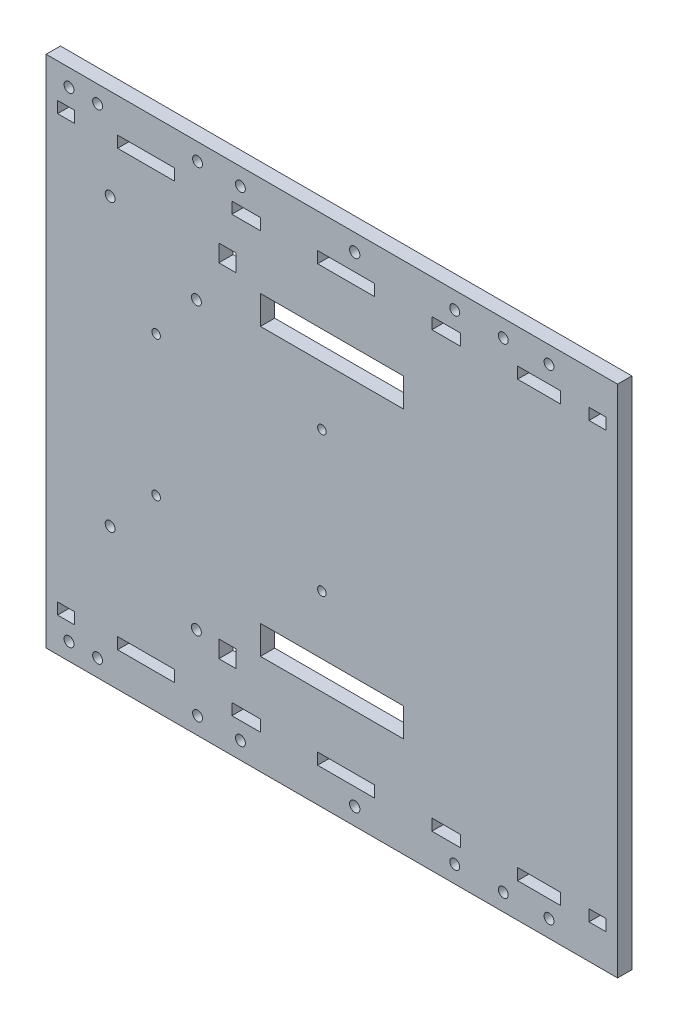
from build123d import *

# Parameters (mm, degrees)
SKETCH1_W           = 200
SKETCH1_H           = 180
BOSS_EXTRUDE1_DEPTH = 5
SKETCH3_W           = 20
SKETCH3_H           = 4
CUT_EXTRUDE1_DEPTH  = 5
SKETCH3_6_W         = 20
SKETCH3_6_H         = 4
CUT_EXTRUDE2_DEPTH  = 5
SKETCH3_7_W         = 15
SKETCH3_7_H         = 4
CUT_EXTRUDE3_DEPTH  = 5
SKETCH5_R           = 1.73
CUT_EXTRUDE4_DEPTH  = 5
SKETCH6_W           = 6
SKETCH6_H           = 4
SKETCH6_W_2         = 10
CUT_EXTRUDE5_DEPTH  = 5
SKETCH6_4_W         = 10
SKETCH6_4_H         = 4
SKETCH6_4_W_2       = 6
CUT_EXTRUDE6_DEPTH  = 5
SKETCH7_R           = 1.73
SKETCH7_R_2         = 1.8
CUT_EXTRUDE7_DEPTH  = 5
CUT_EXTRUDE8_DEPTH  = 5
SKETCH9_R           = 1.5
CUT_EXTRUDE11_DEPTH = 5
SKETCH10_R          = 1.73
CUT_EXTRUDE12_DEPTH = 5
SKETCH10_3_R        = 1.73
CUT_EXTRUDE13_DEPTH = 5
SKETCH11_W          = 6
SKETCH11_H          = 6
CUT_EXTRUDE14_DEPTH = 5


with BuildPart() as part:
    # Sketch1 → Boss-Extrude1 (new body)
    with BuildSketch(Plane.XY):
        Rectangle(SKETCH1_W, SKETCH1_H)
    extrude(amount=BOSS_EXTRUDE1_DEPTH)

    # Sketch3 → Cut-Extrude1 (cut)
    with BuildSketch(Plane.XY.offset(5)):
        with Locations((-65, 76)):
            Rectangle(SKETCH3_W, SKETCH3_H)
    cut_extrude1 = extrude(amount=-CUT_EXTRUDE1_DEPTH, mode=Mode.SUBTRACT)

    # Sketch3<6> → Cut-Extrude2 (cut)
    with BuildSketch(Plane.XY.offset(5)):
        with Locations((5, 76)):
            Rectangle(SKETCH3_6_W, SKETCH3_6_H)
    cut_extrude2 = extrude(amount=-CUT_EXTRUDE2_DEPTH, mode=Mode.SUBTRACT)

    # Sketch3<7> → Cut-Extrude3 (cut)
    with BuildSketch(Plane.XY.offset(5)):
        with Locations((72.5, 76)):
            Rectangle(SKETCH3_7_W, SKETCH3_7_H)
    cut_extrude3 = extrude(amount=-CUT_EXTRUDE3_DEPTH, mode=Mode.SUBTRACT)

    # Mirror1: Cut-Extrude1, Cut-Extrude2, Cut-Extrude3 across plane
    add(cut_extrude1.mirror(Plane.ZX), mode=Mode.SUBTRACT)
    add(cut_extrude2.mirror(Plane.ZX), mode=Mode.SUBTRACT)
    add(cut_extrude3.mirror(Plane.ZX), mode=Mode.SUBTRACT)

    # Sketch5 → Cut-Extrude4 (cut)
    with BuildSketch(Plane.XY.offset(5)):
        with Locations((-92, -84)):
            Circle(SKETCH5_R)
        with Locations((-32, -84)):
            Circle(SKETCH5_R)
        with Locations((43, -84)):
            Circle(SKETCH5_R)
        with Locations((76, -84)):
            Circle(SKETCH5_R)
    cut_extrude4 = extrude(amount=-CUT_EXTRUDE4_DEPTH, mode=Mode.SUBTRACT)

    # Mirror2: Cut-Extrude4 across plane
    add(cut_extrude4.mirror(Plane.ZX), mode=Mode.SUBTRACT)

    # Sketch6 → Cut-Extrude5 (cut)
    with BuildSketch(Plane.XY.offset(5)):
        with Locations((-93, 76)):
            Rectangle(SKETCH6_W, SKETCH6_H)
        with Locations((-30, 76)):
            Rectangle(SKETCH6_W_2, SKETCH6_H)
    cut_extrude5 = extrude(amount=-CUT_EXTRUDE5_DEPTH, mode=Mode.SUBTRACT)

    # Sketch6<4> → Cut-Extrude6 (cut)
    with BuildSketch(Plane.XY.offset(5)):
        with Locations((40, 76)):
            Rectangle(SKETCH6_4_W, SKETCH6_4_H)
        with Locations((93, 76)):
            Rectangle(SKETCH6_4_W_2, SKETCH6_4_H)
    cut_extrude6 = extrude(amount=-CUT_EXTRUDE6_DEPTH, mode=Mode.SUBTRACT)

    # Mirror3: Cut-Extrude5, Cut-Extrude6 across plane
    add(cut_extrude5.mirror(Plane.ZX), mode=Mode.SUBTRACT)
    add(cut_extrude6.mirror(Plane.ZX), mode=Mode.SUBTRACT)

    # Sketch7 → Cut-Extrude7 (cut)
    with BuildSketch(Plane.XY.offset(5)):
        with Locations((-82, -84)):
            Circle(SKETCH7_R)
        with Locations((-47, -84)):
            Circle(SKETCH7_R)
        with Locations((8, -84)):
            Circle(SKETCH7_R_2)
        with Locations((60, -84)):
            Circle(SKETCH7_R)
    cut_extrude7 = extrude(amount=-CUT_EXTRUDE7_DEPTH, mode=Mode.SUBTRACT)

    # Mirror4: Cut-Extrude7 across plane
    add(cut_extrude7.mirror(Plane.ZX), mode=Mode.SUBTRACT)

    # Sketch8 → Cut-Extrude8 (cut)
    with BuildSketch(Plane.XY.offset(5)):
        Polygon((0, 45), (25, 45), (25, 55), (0, 55), (-25, 55), (-25, 45), align=None)
    cut_extrude8 = extrude(amount=-CUT_EXTRUDE8_DEPTH, mode=Mode.SUBTRACT)

    # Mirror5: Cut-Extrude8 across plane
    add(cut_extrude8.mirror(Plane.ZX), mode=Mode.SUBTRACT)

    # Sketch9 → Cut-Extrude11 (cut)
    with BuildSketch(Plane.XY.offset(5)):
        with Locations((-3.5, 24.5)):
            Circle(SKETCH9_R)
        with Locations((-61.5, 24.5)):
            Circle(SKETCH9_R)
    cut_extrude11 = extrude(amount=-CUT_EXTRUDE11_DEPTH, mode=Mode.SUBTRACT)

    # Mirror7: Cut-Extrude11 across plane
    add(cut_extrude11.mirror(Plane.ZX), mode=Mode.SUBTRACT)

    # Sketch10 → Cut-Extrude12 (cut)
    with BuildSketch(Plane.XY.offset(5)):
        with Locations((-77.6, -41.875)):
            Circle(SKETCH10_R)
        with Locations((-47.4, -58.125)):
            Circle(SKETCH10_R)
    extrude(amount=-CUT_EXTRUDE12_DEPTH, mode=Mode.SUBTRACT)

    # Sketch10<3> → Cut-Extrude13 (cut)
    with BuildSketch(Plane.XY.offset(5)):
        with Locations((-47.4, 41.88)):
            Circle(SKETCH10_3_R)
        with Locations((-77.6, 58.13)):
            Circle(SKETCH10_3_R)
    extrude(amount=-CUT_EXTRUDE13_DEPTH, mode=Mode.SUBTRACT)

    # Sketch11 → Cut-Extrude14 (cut)
    with BuildSketch(Plane.XY.offset(5)):
        with Locations((-36.5665421, 60)):
            Rectangle(SKETCH11_W, SKETCH11_H)
    cut_extrude14 = extrude(amount=-CUT_EXTRUDE14_DEPTH, mode=Mode.SUBTRACT)

    # Mirror9: Cut-Extrude14 across plane
    add(cut_extrude14.mirror(Plane.ZX), mode=Mode.SUBTRACT)


solid = part.part
